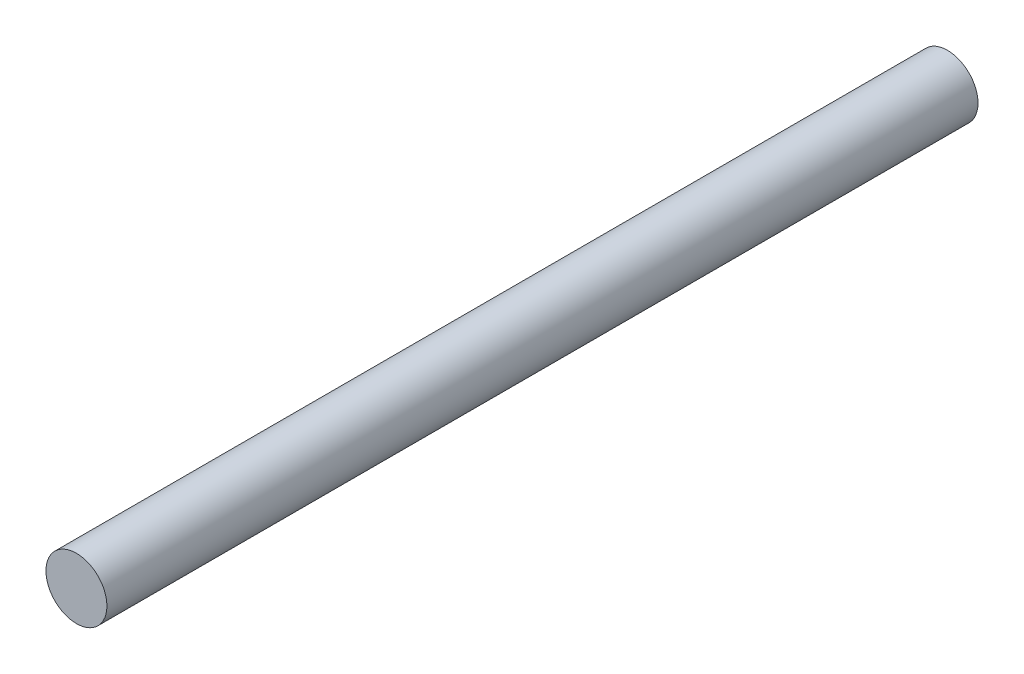
from build123d import *

# Parameters (mm, degrees)
SKETCH1_R           = 17.5
BOSS_EXTRUDE1_DEPTH = 500
SKETCH3_W           = 13
SKETCH3_H           = 60


with BuildPart() as part:
    # Sketch1 → Boss-Extrude1 (new body)
    with BuildSketch(Plane.XY):
        Circle(SKETCH1_R)
    extrude(amount=-BOSS_EXTRUDE1_DEPTH)

    # Sketch3 → Cut-Revolve1 (revolve, cut)
    with BuildSketch(Plane(origin=(0, 0, 0), x_dir=(1, 0, 0), z_dir=(0, 1, 0))):
        with Locations((6.5, 470)):
            Rectangle(SKETCH3_W, SKETCH3_H)
    revolve(axis=Axis((0, 0, -500), (0, 0, -1)), mode=Mode.SUBTRACT)


solid = part.part
